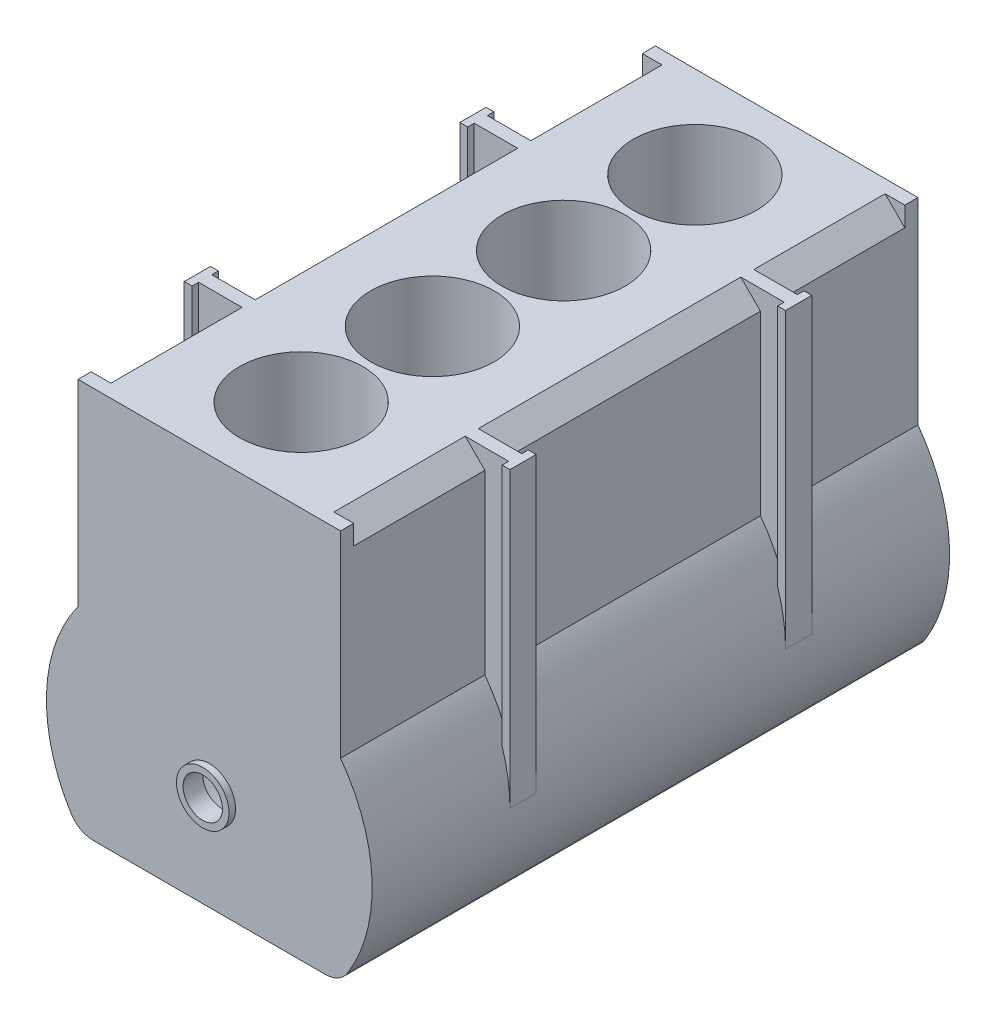
from build123d import *

# Parameters (mm, degrees)
SKETCH1_R                = 15
BOSS_EXTRUDE1_DEPTH      = 10
SKETCH2_W                = 200
SKETCH2_H                = 150
BOSS_EXTRUDE2_DEPTH      = 420
SKETCH3_R                = 47
CUT_EXTRUDE1_DEPTH       = 150
CHAMFER2_SIZE            = 15
BOSS_EXTRUDE3_START      = 10
BOSS_EXTRUDE3_DEPTH      = 420
BOSS_EXTRUDE4_DEPTH      = 5
BOSS_EXTRUDE4_DEPTH_BACK = 5
BOSS_EXTRUDE4_START      = 115
SKETCH5_W                = 39.105801637
SKETCH5_H                = 223.5
BOSS_EXTRUDE5_DEPTH      = 5
BOSS_EXTRUDE5_DEPTH_BACK = 5
BOSS_EXTRUDE5_START      = 325
SKETCH5_3_W              = 39.105801637
SKETCH5_3_H              = 223.5
BOSS_EXTRUDE6_DEPTH      = 10
BOSS_EXTRUDE6_DEPTH_BACK = 10
BOSS_EXTRUDE6_START      = 115
SKETCH5_4_W              = 6
SKETCH5_4_H              = 223.5
BOSS_EXTRUDE7_DEPTH      = 10
BOSS_EXTRUDE7_DEPTH_BACK = 10
BOSS_EXTRUDE7_START      = 325
SKETCH5_5_W              = 6
SKETCH5_5_H              = 223.5
SKETCH10_R               = 15
BOSS_EXTRUDE8_DEPTH      = 10
SKETCH10_3_R             = 20
SKETCH10_3_R_2           = 15
BOSS_EXTRUDE9_DEPTH      = 15


with BuildPart() as part:
    # Sketch1 → Boss-Extrude1 (new body)
    with BuildSketch(Plane.XY):
        with BuildLine():
            Line((-100, 223.5), (-100, 73.5))
            ThreePointArc((-100, 73.5), (-124.013298207, 4.790810776), (-105.372324855, -65.566173861))
            ThreePointArc((-105.372324855, -65.566173861), (-98.104066029, -72.483184453), (-88.39127748, -75))
            Line((-88.39127748, -75), (88.39127748, -75))
            ThreePointArc((88.39127748, -75), (98.104066029, -72.483184453), (105.372324855, -65.566173861))
            ThreePointArc((105.372324855, -65.566173861), (124.013298207, 4.790810776), (100, 73.5))
            Line((100, 73.5), (100, 223.5))
            Line((100, 223.5), (-100, 223.5))
        make_face()
        Circle(SKETCH1_R, mode=Mode.SUBTRACT)
    extrude(amount=BOSS_EXTRUDE1_DEPTH)



with BuildPart() as body_2:
    # Sketch2 → Boss-Extrude2 (new body)
    with BuildSketch(Plane.XY.offset(10)):
        with Locations((0, 148.5)):
            Rectangle(SKETCH2_W, SKETCH2_H)
    extrude(amount=BOSS_EXTRUDE2_DEPTH)

    # Sketch3 → Cut-Extrude1 (cut)
    with BuildSketch(Plane(origin=(0, 223.5, 0), x_dir=(1, 0, 0), z_dir=(0, 1, 0))):
        with Locations((0, -370)):
            Circle(SKETCH3_R)
        with Locations((0, -270)):
            Circle(SKETCH3_R)
        with Locations((0, -170)):
            Circle(SKETCH3_R)
        with Locations((0, -70)):
            Circle(SKETCH3_R)
    extrude(amount=-CUT_EXTRUDE1_DEPTH, mode=Mode.SUBTRACT)

    # Chamfer2
    chamfer2_edges = [body_2.edges().sort_by_distance(p)[0] for p in [
        (-100, 223.5, 220),
        (100, 223.5, 220),
    ]]
    chamfer(chamfer2_edges, length=CHAMFER2_SIZE)


with BuildPart() as part_1:
    add(part.part)

    add(body_2.part)  # Boss-Extrude3 merges body 2
    # Sketch4 → Boss-Extrude3 (add)
    with BuildSketch(Plane.XY.offset(BOSS_EXTRUDE3_START)):
        with BuildLine():
            Line((88.39127748, -75), (-88.39127748, -75))
            ThreePointArc((-88.39127748, -75), (-98.104066029, -72.483184453), (-105.372324855, -65.566173861))
            ThreePointArc((-105.372324855, -65.566173861), (-124.013298207, 4.790810776), (-100, 73.5))
            Line((-100, 73.5), (-55, 73.5))
            ThreePointArc((-55, 73.5), (-62.071067812, 70.571067812), (-65, 63.5))
            Line((-65, 63.5), (-65, 0))
            ThreePointArc((-65, 0), (0, -65), (65, 0))
            Line((65, 0), (65, 63.5))
            ThreePointArc((65, 63.5), (62.071067812, 70.571067812), (55, 73.5))
            Line((55, 73.5), (100, 73.5))
            ThreePointArc((100, 73.5), (124.013298207, 4.790810776), (105.372324855, -65.566173861))
            ThreePointArc((105.372324855, -65.566173861), (98.104066029, -72.483184453), (88.39127748, -75))
        make_face()
    extrude(amount=BOSS_EXTRUDE3_DEPTH)

    # Sketch5 → Boss-Extrude4 (add, two sides: drawn at the far end of the back side and taken through both)
    with BuildSketch(Plane.XY.offset(BOSS_EXTRUDE4_START - BOSS_EXTRUDE4_DEPTH_BACK)):
        with Locations((-104.552900819, 111.75)):
            Rectangle(SKETCH5_W, SKETCH5_H)
        with Locations((104.552900819, 111.75)):
            Rectangle(SKETCH5_W, SKETCH5_H)
    extrude(amount=BOSS_EXTRUDE4_DEPTH + BOSS_EXTRUDE4_DEPTH_BACK)

    # Sketch5<3> → Boss-Extrude5 (add, two sides: drawn at the far end of the back side and taken through both)
    with BuildSketch(Plane.XY.offset(BOSS_EXTRUDE5_START - BOSS_EXTRUDE5_DEPTH_BACK)):
        with Locations((-104.552900819, 111.75)):
            Rectangle(SKETCH5_3_W, SKETCH5_3_H)
        with Locations((104.552900819, 111.75)):
            Rectangle(SKETCH5_3_W, SKETCH5_3_H)
    extrude(amount=BOSS_EXTRUDE5_DEPTH + BOSS_EXTRUDE5_DEPTH_BACK)

    # Sketch5<4> → Boss-Extrude6 (add, two sides: drawn at the far end of the back side and taken through both)
    with BuildSketch(Plane.XY.offset(BOSS_EXTRUDE6_START - BOSS_EXTRUDE6_DEPTH_BACK)):
        with Locations((-121.105801637, 111.75)):
            Rectangle(SKETCH5_4_W, SKETCH5_4_H)
        with Locations((121.105801637, 111.75)):
            Rectangle(SKETCH5_4_W, SKETCH5_4_H)
    extrude(amount=BOSS_EXTRUDE6_DEPTH + BOSS_EXTRUDE6_DEPTH_BACK)

    # Sketch5<5> → Boss-Extrude7 (add, two sides: drawn at the far end of the back side and taken through both)
    with BuildSketch(Plane.XY.offset(BOSS_EXTRUDE7_START - BOSS_EXTRUDE7_DEPTH_BACK)):
        with Locations((-121.105801637, 111.75)):
            Rectangle(SKETCH5_5_W, SKETCH5_5_H)
        with Locations((121.105801637, 111.75)):
            Rectangle(SKETCH5_5_W, SKETCH5_5_H)
    extrude(amount=BOSS_EXTRUDE7_DEPTH + BOSS_EXTRUDE7_DEPTH_BACK)

    # Sketch10 → Boss-Extrude8 (add)
    with BuildSketch(Plane.XY.offset(430)):
        with BuildLine():
            Line((100, 223.5), (-100, 223.5))
            Line((-100, 223.5), (-100, 73.5))
            ThreePointArc((-100, 73.5), (-124.013298207, 4.790810776), (-105.372324855, -65.566173861))
            ThreePointArc((-105.372324855, -65.566173861), (-98.104066029, -72.483184453), (-88.39127748, -75))
            Line((-88.39127748, -75), (88.39127748, -75))
            ThreePointArc((88.39127748, -75), (98.104066029, -72.483184453), (105.372324855, -65.566173861))
            ThreePointArc((105.372324855, -65.566173861), (124.013298207, 4.790810776), (100, 73.5))
            Line((100, 73.5), (100, 223.5))
        make_face()
        Circle(SKETCH10_R, mode=Mode.SUBTRACT)
    extrude(amount=BOSS_EXTRUDE8_DEPTH)

    # Sketch10<3> → Boss-Extrude9 (add)
    with BuildSketch(Plane.XY.offset(430)):
        Circle(SKETCH10_3_R)
        Circle(SKETCH10_3_R_2, mode=Mode.SUBTRACT)
    extrude(amount=BOSS_EXTRUDE9_DEPTH)


solid = part_1.part
